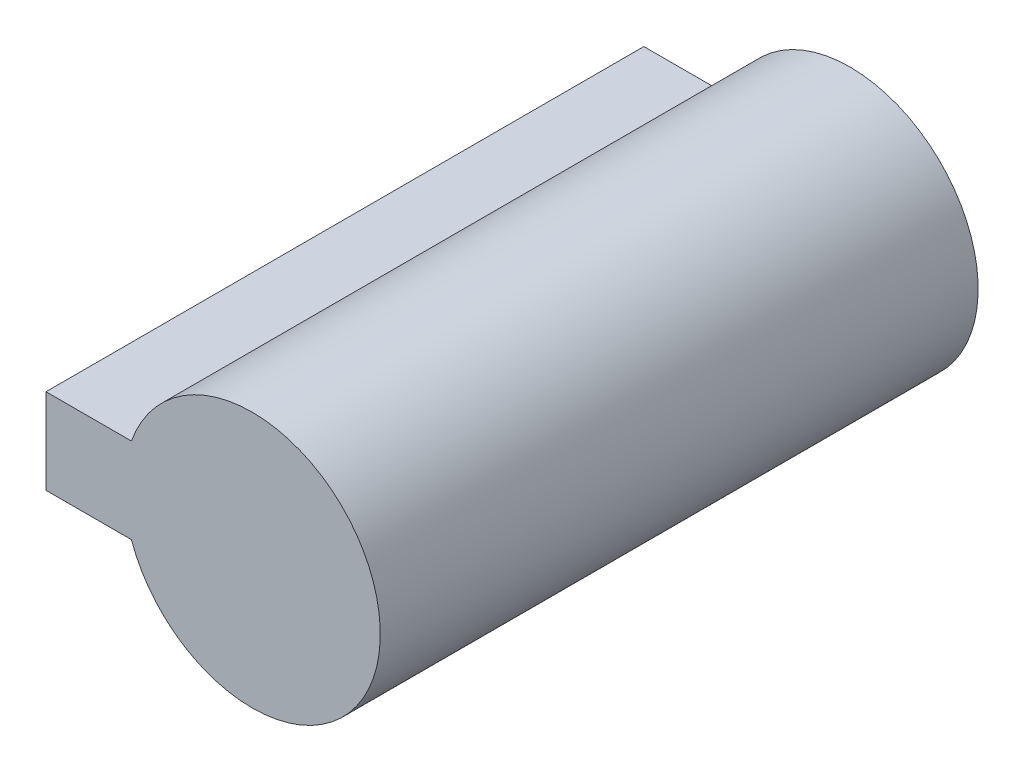
from build123d import *

# Parameters (mm, degrees)
BOSS_EXTRUDE1_DEPTH = 70


with BuildPart() as part:
    # Sketch1 → Boss-Extrude1 (new body)
    with BuildSketch(Plane.XY):
        with BuildLine():
            Line((-14.142135624, 5), (-24.142135624, 5))
            Line((-24.142135624, 5), (-24.142135624, -5))
            Line((-24.142135624, -5), (-14.142135624, -5))
            ThreePointArc((-14.142135624, -5), (15, 0), (-14.142135624, 5))
        make_face()
    extrude(amount=BOSS_EXTRUDE1_DEPTH)


solid = part.part
